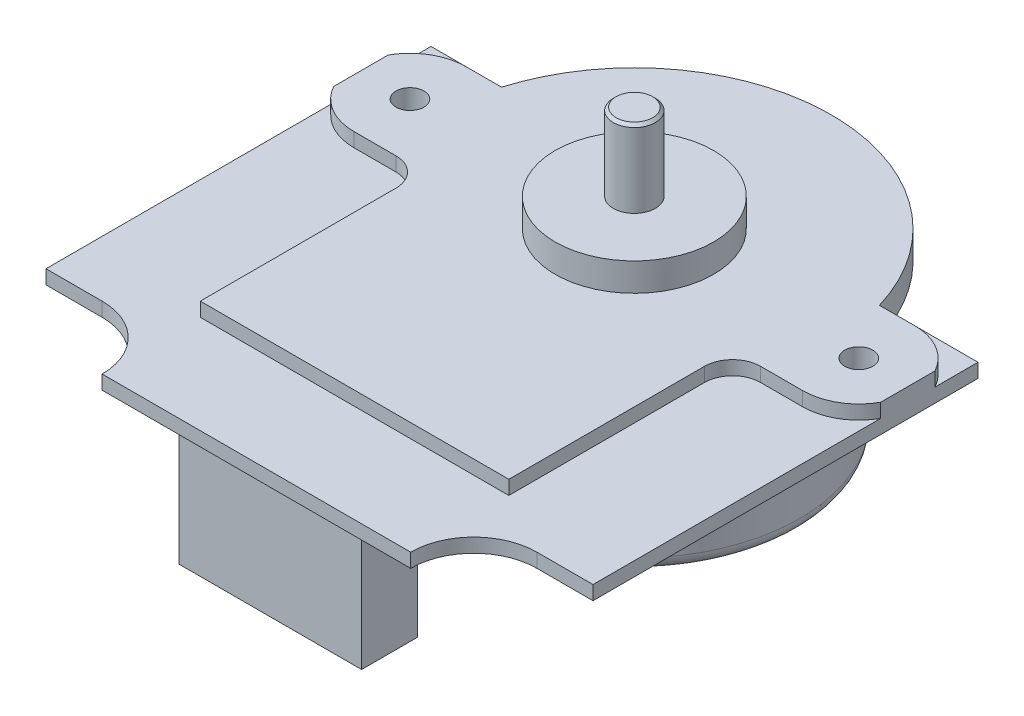
from build123d import *

# Parameters (mm, degrees)
SKETCH_1_R           = 1
EXTRUDE_1_DEPTH      = 2
SKETCH_2_R           = 5.65
EXTRUDE_2_DEPTH      = 2
EXTRUDE_3_DEPTH      = 5.5
EXTRUDE_3_DEPTH_BACK = 15
SKETCH_3_R           = 1.5
SKETCH_4_W           = 11.8
SKETCH_4_H           = 8
FILLET_1_R           = 1
SKETCH_5_OUTSIDE_W   = 53.038
SKETCH_5_OUTSIDE_H   = 55.038
CUT_EXTRUDE_4_DEPTH  = 1
FILLET_2_R           = 2
CHAMFER_1_SIZE       = 0.2
SKETCH_6_W           = 13
SKETCH_6_H           = 4
EXTRUDE_4_DEPTH      = 9


with BuildPart() as part:
    # 草图1 → 凸台-拉伸1 (new body)
    with BuildSketch(Plane(origin=(0, 0, 0), x_dir=(1, 0, 0), z_dir=(0, 1, 0))):
        with BuildLine():
            Line((-19.5, 15.975), (-13.13021325, 15.975))
            ThreePointArc((-13.13021325, 15.975), (0, 25.025), (13.13021325, 15.975))
            Line((13.13021325, 15.975), (19.5, 15.975))
            Line((19.5, 15.975), (19.5, -11.475))
            Line((19.5, -11.475), (15.5, -11.475))
            ThreePointArc((15.5, -11.475), (12.318019485, -12.793019485), (11, -15.975))
            Line((11, -15.975), (-11, -15.975))
            ThreePointArc((-11, -15.975), (-12.318019485, -12.793019485), (-15.5, -11.475))
            Line((-15.5, -11.475), (-19.5, -11.475))
            Line((-19.5, -11.475), (-19.5, 15.975))
        make_face()
        with Locations(Location((16, 10.975, 0), (0, 0, 270))):
            Circle(SKETCH_1_R, mode=Mode.SUBTRACT)
        with Locations(Location((-16, 10.975, 0), (0, 0, 90))):
            Circle(SKETCH_1_R, mode=Mode.SUBTRACT)
    extrude(amount=EXTRUDE_1_DEPTH)

    # 草图2 → 凸台-拉伸2 (add)
    with BuildSketch(Plane(origin=(0, 2, 0), x_dir=(1, 0, 0), z_dir=(0, 1, 0))):
        with Locations(Location((0, 10.975, 0), (0, 0, 90))):
            Circle(SKETCH_2_R)
    extrude(amount=EXTRUDE_2_DEPTH)

    # 草图3 → 凸台-拉伸3 (add, two sides: drawn at the far end of the back side and taken through both)
    with BuildSketch(Plane(origin=(0, 4, 0), x_dir=(1, 0, 0), z_dir=(0, 1, 0)).offset(-EXTRUDE_3_DEPTH_BACK)):
        with Locations(Location((0, 10.975, 0), (0, 0, 270))):
            Circle(SKETCH_3_R)
    extrude(amount=EXTRUDE_3_DEPTH + EXTRUDE_3_DEPTH_BACK)

    # 草图4 → 旋转1 (revolve)
    with BuildSketch(Plane(origin=(0, 0, 0), x_dir=(0, 0, -1), z_dir=(1, 0, 0))):
        with Locations((5.075, -7)):
            Rectangle(SKETCH_4_W, SKETCH_4_H)
    revolve(axis=Axis((0, 9.5, -10.975), (0, -1, 0)))

    # 圆角1
    fillet_1_edges = [part.edges().sort_by_distance(p)[0] for p in [
        (0, -11, -22.775),
    ]]
    fillet(fillet_1_edges, radius=FILLET_1_R)

    # 草图5 outside → 切除-拉伸4 (cut)
    with BuildSketch(Plane(origin=(0, 2, 0), x_dir=(1, 0, 0), z_dir=(0, 1, 0))):
        with Locations((0, 4.525)):
            Rectangle(SKETCH_5_OUTSIDE_W, SKETCH_5_OUTSIDE_H)
        with BuildLine():
            Line((-11, -8.975), (11, -8.975))
            Line((11, -8.975), (11, 6.975))
            Line((11, 6.975), (16, 6.975))
            ThreePointArc((16, 6.975), (20, 10.975), (16, 14.975))
            Line((16, 14.975), (13.468574535, 14.975))
            ThreePointArc((13.468574535, 14.975), (0, 25.025), (-13.468574535, 14.975))
            Line((-13.468574535, 14.975), (-16, 14.975))
            ThreePointArc((-16, 14.975), (-20, 10.975), (-16, 6.975))
            Line((-16, 6.975), (-11, 6.975))
            Line((-11, 6.975), (-11, -8.975))
        make_face(mode=Mode.SUBTRACT)
    extrude(amount=-CUT_EXTRUDE_4_DEPTH, mode=Mode.SUBTRACT)

    # 圆角2
    fillet_2_edges = [part.edges().sort_by_distance(p)[0] for p in [
        (-11, 1.5, -6.975),
        (11, 1.5, -6.975),
    ]]
    fillet(fillet_2_edges, radius=FILLET_2_R)

    # 倒角1
    chamfer_1_edges = [part.edges().sort_by_distance(p)[0] for p in [
        (0, 9.5, -12.475),
        (0, -3, -22.775),
    ]]
    chamfer(chamfer_1_edges, length=CHAMFER_1_SIZE)

    # 草图6 → 凸台-拉伸4 (add)
    with BuildSketch(Plane.XZ):
        with Locations((0, 12.975)):
            Rectangle(SKETCH_6_W, SKETCH_6_H)
    extrude(amount=EXTRUDE_4_DEPTH)


solid = part.part
